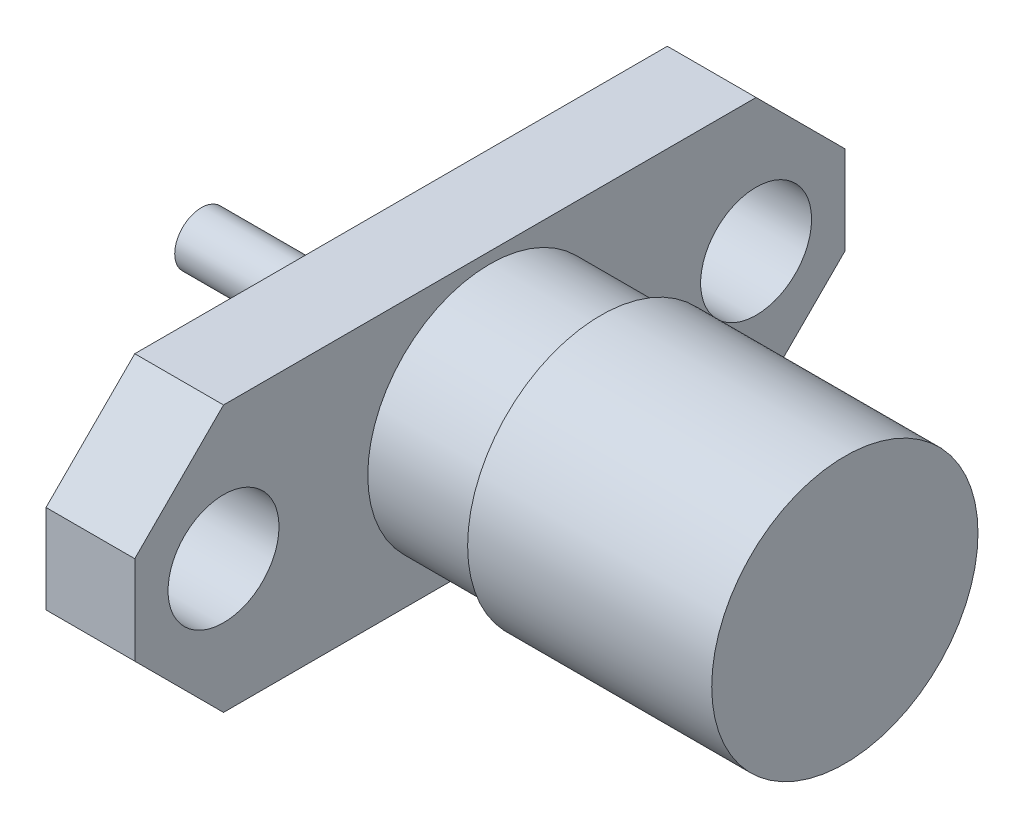
from build123d import *

# Parameters (mm, degrees)
SKETCH_1_R          = 1.25
EXTRUDE_1_DEPTH     = 2
SKETCH_2_R          = 2.25
CUT_EXTRUDE_1_DEPTH = 0.1
SKETCH_6_R          = 0.6
EXTRUDE_2_DEPTH     = 4.6
SKETCH_7_R          = 3
EXTRUDE_3_DEPTH     = 8
SKETCH_8_W          = 2.5
SKETCH_8_H          = 0.25


with BuildPart() as part:
    # Эскиз1 → Бобышка-Вытянуть1 (new body)
    with BuildSketch(Plane(origin=(0, 0, 0), x_dir=(0, 0, -1), z_dir=(1, 0, 0))):
        Polygon((-6, 3), (-8, 1), (-8, -1), (-6, -3), (6, -3), (8, -1), (8, 1), (6, 3), align=None)
        with Locations((-6, 0)):
            Circle(SKETCH_1_R, mode=Mode.SUBTRACT)
        with Locations((6, 0)):
            Circle(SKETCH_1_R, mode=Mode.SUBTRACT)
    extrude(amount=EXTRUDE_1_DEPTH)

    # Эскиз2 → Вырез-Вытянуть1 (cut)
    with BuildSketch(Plane.ZY):
        Circle(SKETCH_2_R)
    extrude(amount=-CUT_EXTRUDE_1_DEPTH, mode=Mode.SUBTRACT)

    # Эскиз6 → Бобышка-Вытянуть2 (add)
    with BuildSketch(Plane.ZY.offset(-0.1)):
        Circle(SKETCH_6_R)
    extrude(amount=EXTRUDE_2_DEPTH)

    # Эскиз7 → Бобышка-Вытянуть3 (add)
    with BuildSketch(Plane(origin=(2, 0, 0), x_dir=(0, 0, -1), z_dir=(1, 0, 0))):
        with Locations(Location((0, 0, 0), (0, 0, 270))):
            Circle(SKETCH_7_R)
    extrude(amount=EXTRUDE_3_DEPTH)

    # Эскиз8 → Вырез-Повернуть1 (revolve, cut)
    with BuildSketch(Plane.XY, mode=Mode.PRIVATE) as cut_revolve_1_sk:
        with Locations((3.25, 2.875)):
            Rectangle(SKETCH_8_W, SKETCH_8_H)
    revolve(cut_revolve_1_sk.sketch.rotate(Axis((-1000, 0, 0), (1, 0, 0)), 90), axis=Axis((-1000, 0, 0), (1, 0, 0)), mode=Mode.SUBTRACT)


solid = part.part
